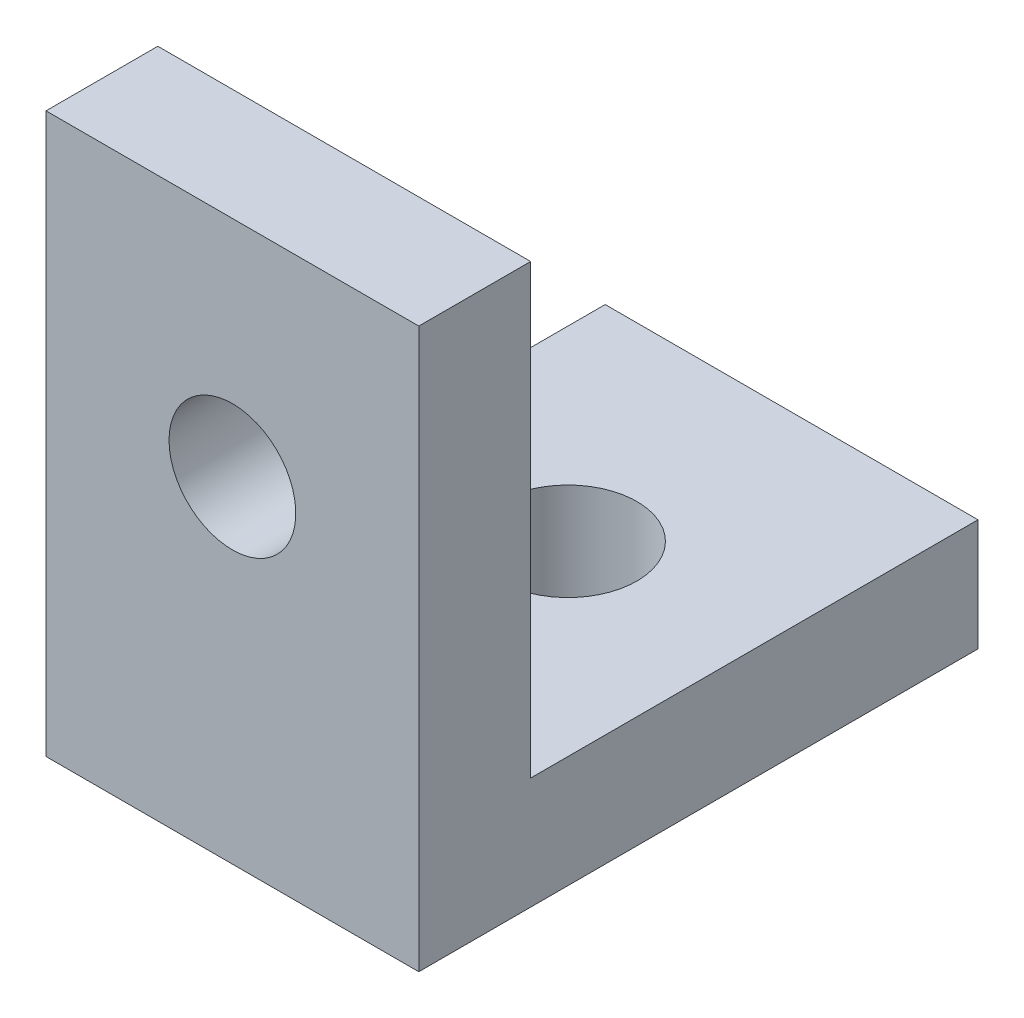
from build123d import *

# Parameters (mm, degrees)
BOSS_EXTRUDE1_DEPTH = 10
SKETCH2_R           = 1.85
CUT_EXTRUDE1_DEPTH  = 20.697715604
SKETCH4_R           = 1.7
CUT_EXTRUDE2_DEPTH  = 20.697715604


with BuildPart() as part:
    # Sketch1 → Boss-Extrude1 (new body)
    with BuildSketch(Plane(origin=(0, 0, 0), x_dir=(0, 0, -1), z_dir=(1, 0, 0))):
        Polygon((-3, 12), (0, 12), (0, 0), (12, 0), (12, -3), (-3, -3), align=None)
    extrude(amount=BOSS_EXTRUDE1_DEPTH)

    # Sketch2 → Cut-Extrude1 (cut, through all)
    with BuildSketch(Plane(origin=(0, 0, 0), x_dir=(1, 0, 0), z_dir=(0, 1, 0))):
        with Locations(Location((5, 6, 0), (0, 0, 270))):
            Circle(SKETCH2_R)
    extrude(amount=-CUT_EXTRUDE1_DEPTH, mode=Mode.SUBTRACT)

    # Sketch4 → Cut-Extrude2 (cut, through all)
    with BuildSketch(Plane(origin=(0, 0, 0), x_dir=(-1, 0, 0), z_dir=(0, 0, -1))):
        with Locations((-5, 6)):
            Circle(SKETCH4_R)
    extrude(amount=-CUT_EXTRUDE2_DEPTH, mode=Mode.SUBTRACT)


solid = part.part
